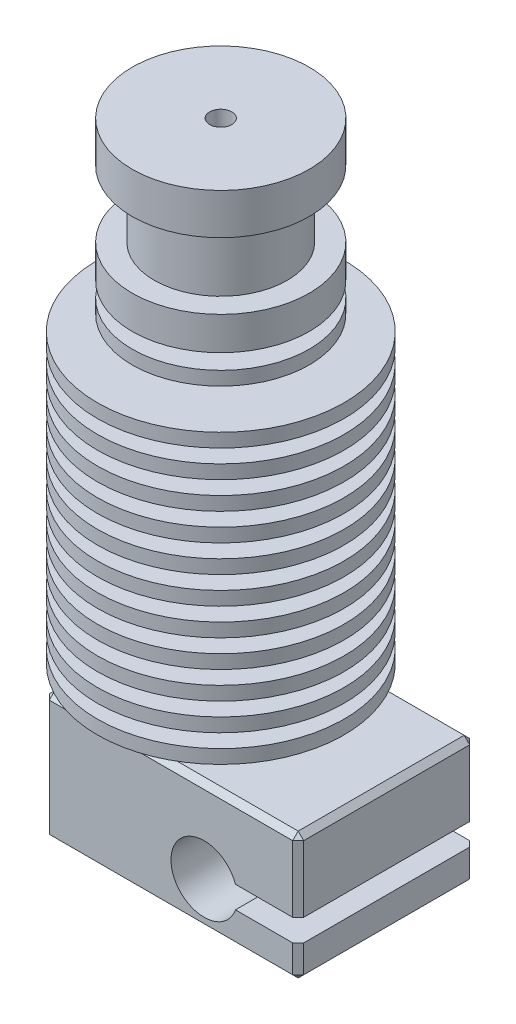
from build123d import *

# Parameters (mm, degrees)
SKETCH2_W           = 23
SKETCH2_H           = 16
BOSS_EXTRUDE1_DEPTH = 11.5
CUT_EXTRUDE1_DEPTH  = 21.5
CHAMFER1_SIZE       = 0.5
SKETCH4_R           = 1
CUT_EXTRUDE2_DEPTH  = 56


with BuildPart() as part:
    # Sketch1 → Revolve1 (revolve)
    with BuildSketch(Plane.XY, mode=Mode.PRIVATE) as revolve1_sk:
        Polygon((5.807089278, 12.7), (-2.192910722, 12.7), (-2.192910722, 9), (-0.192910722, 9), (-0.192910722, 3), (-2.192910722, 3), (-2.192910722, 0), (1.617747359, 0), (1.617747359, -1.380952381), (-2.192910722, -1.380952381), (-2.192910722, -2.619047619), (1.617747359, -2.619047619), (1.617747359, -4), (-5.342910722, -4), (-5.342910722, -5.238095238), (1.617747359, -5.238095238), (1.617747359, -6.476190476), (-5.342910722, -6.476190476), (-5.342910722, -7.714285714), (1.617747359, -7.714285714), (1.617747359, -8.952380952), (-5.342910722, -8.952380952), (-5.342910722, -10.19047619), (1.617747359, -10.19047619), (1.617747359, -11.428571429), (-5.342910722, -11.428571429), (-5.342910722, -12.666666667), (1.617747359, -12.666666667), (1.617747359, -13.904761905), (-5.342910722, -13.904761905), (-5.342910722, -15.142857143), (1.617747359, -15.142857143), (1.617747359, -16.380952381), (-5.342910722, -16.380952381), (-5.342910722, -17.619047619), (1.617747359, -17.619047619), (1.617747359, -18.857142857), (-5.342910722, -18.857142857), (-5.342910722, -20.095238095), (1.617747359, -20.095238095), (1.617747359, -21.333333333), (-5.342910722, -21.333333333), (-5.342910722, -22.571428571), (1.617747359, -22.571428571), (1.617747359, -23.80952381), (-5.342910722, -23.80952381), (-5.342910722, -25.047619048), (1.617747359, -25.047619048), (1.617747359, -26.285714286), (-5.342910722, -26.285714286), (-5.342910722, -27.523809524), (1.617747359, -27.523809524), (1.617747359, -28.761904762), (-5.342910722, -28.761904762), (-5.342910722, -30), (4.407089278, -30), (4.407089278, -32.1), (5.807089278, -32.1), (5.807089278, -23.767155517), align=None)
    revolve(revolve1_sk.sketch.rotate(Axis((5.807089278, 12.7, 0), (0, -1, 0)), 270), axis=Axis((5.807089278, 12.7, 0), (0, -1, 0)))

    # Sketch2 → Boss-Extrude1 (add)
    with BuildSketch(Plane.XZ.offset(32.1)):
        with Locations((9.307089278, 0)):
            Rectangle(SKETCH2_W, SKETCH2_H)
    extrude(amount=BOSS_EXTRUDE1_DEPTH)

    # Sketch3 → Cut-Extrude1 (cut)
    with BuildSketch(Plane(origin=(0, 0, -8), x_dir=(-1, 0, 0), z_dir=(0, 0, -1))):
        with BuildLine():
            Line((-20.807089278, -38.6), (-20.807089278, -40.6))
            Line((-20.807089278, -40.6), (-15.135516403, -40.6))
            ThreePointArc((-15.135516403, -40.6), (-15.307089278, -39.6), (-15.135516403, -38.6))
            Line((-15.135516403, -38.6), (-20.807089278, -38.6))
        make_face()
        with BuildLine():
            ThreePointArc((-15.135516403, -38.6), (-15.307089278, -39.6), (-15.135516403, -40.6))
            Line((-15.135516403, -40.6), (-12.923340637, -40.6))
            Line((-12.923340637, -40.6), (-12.923340637, -38.6))
            Line((-12.923340637, -38.6), (-15.135516403, -38.6))
        make_face()
        with BuildLine():
            Line((-12.923340637, -40.6), (-15.135516403, -40.6))
            ThreePointArc((-15.135516403, -40.6), (-11.799783342, -42.556795679), (-9.307089278, -39.6))
            ThreePointArc((-9.307089278, -39.6), (-11.799783342, -36.643204321), (-15.135516403, -38.6))
            Line((-15.135516403, -38.6), (-12.923340637, -38.6))
            Line((-12.923340637, -38.6), (-12.923340637, -40.6))
        make_face()
    extrude(amount=-CUT_EXTRUDE1_DEPTH, mode=Mode.SUBTRACT)

    # Chamfer1
    chamfer1_edges = [part.edges().sort_by_distance(p)[0] for p in [
        (5.807089278, -32.1, -1.4),
        (-2.192910722, -32.1, 0),
        (-2.192910722, -37.85, 8),
        (9.307089278, -32.1, -8),
        (-2.192910722, -37.85, -8),
        (20.807089278, -32.1, 0),
        (20.807089278, -42.1, -8),
        (9.307089278, -32.1, 8),
        (20.807089278, -42.1, 8),
        (-2.192910722, -43.6, 0),
        (9.307089278, -43.6, -8),
        (20.807089278, -43.6, 0),
        (9.307089278, -43.6, 8),
        (20.807089278, -35.35, 8),
        (20.807089278, -35.35, -8),
    ]]
    chamfer(chamfer1_edges, length=CHAMFER1_SIZE)

    # Sketch4 → Cut-Extrude2 (cut)
    with BuildSketch(Plane(origin=(0, 12.7, 0), x_dir=(1, 0, 0), z_dir=(0, 1, 0))):
        with Locations(Location((5.807089278, 0, 0), (0, 0, 180))):
            Circle(SKETCH4_R)
    extrude(amount=-CUT_EXTRUDE2_DEPTH, mode=Mode.SUBTRACT)


solid = part.part
